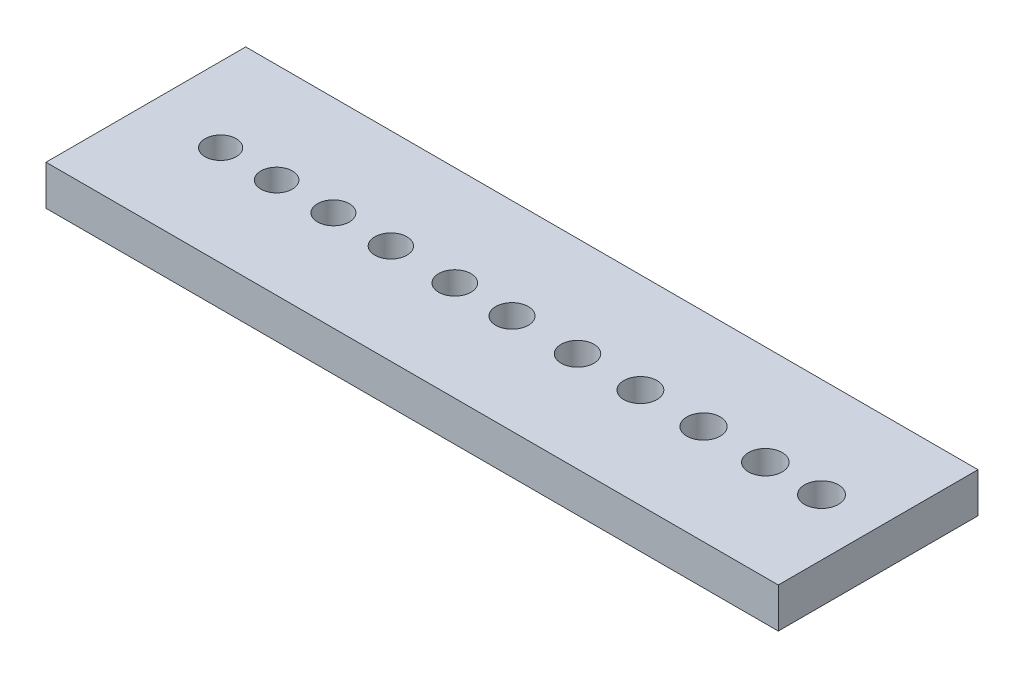
from build123d import *

# Parameters (mm, degrees)
CROQUIS1_W              = 55
CROQUIS1_H              = 15
CROQUIS1_R              = 1.175
CROQUIS1_R_2            = 1.185
CROQUIS1_R_3            = 1.195
CROQUIS1_R_4            = 1.205
CROQUIS1_R_5            = 1.215
CROQUIS1_R_6            = 1.225
CROQUIS1_R_7            = 1.235
CROQUIS1_R_8            = 1.245
CROQUIS1_R_9            = 1.255
CROQUIS1_R_10           = 1.265
CROQUIS1_R_11           = 1.275
SALIENTE_EXTRUIR1_DEPTH = 3


with BuildPart() as part:
    # Croquis1 → Saliente-Extruir1 (new body)
    with BuildSketch(Plane(origin=(0, 0, 0), x_dir=(1, 0, 0), z_dir=(0, 1, 0))):
        Rectangle(CROQUIS1_W, CROQUIS1_H)
        with Locations(Location((-21.88537105, 0, 0), (0, 0, 270))):
            Circle(CROQUIS1_R, mode=Mode.SUBTRACT)
        with Locations(Location((-17.678607244, 0, 0), (0, 0, 270))):
            Circle(CROQUIS1_R_2, mode=Mode.SUBTRACT)
        with Locations(Location((-13.4135496, 0, 0), (0, 0, 270))):
            Circle(CROQUIS1_R_3, mode=Mode.SUBTRACT)
        with Locations(Location((-9.099468305, 0, 0), (0, 0, 270))):
            Circle(CROQUIS1_R_4, mode=Mode.SUBTRACT)
        with Locations(Location((-4.295150499, 0, 0), (0, 0, 270))):
            Circle(CROQUIS1_R_5, mode=Mode.SUBTRACT)
        with Locations(Location((0, 0, 0), (0, 0, 270))):
            Circle(CROQUIS1_R_6, mode=Mode.SUBTRACT)
        with Locations(Location((4.921295904, 0, 0), (0, 0, 270))):
            Circle(CROQUIS1_R_7, mode=Mode.SUBTRACT)
        with Locations(Location((9.643654095, 0, 0), (0, 0, 270))):
            Circle(CROQUIS1_R_8, mode=Mode.SUBTRACT)
        with Locations(Location((14.38652568, 0, 0), (0, 0, 270))):
            Circle(CROQUIS1_R_9, mode=Mode.SUBTRACT)
        with Locations(Location((19.028560127, 0, 0), (0, 0, 270))):
            Circle(CROQUIS1_R_10, mode=Mode.SUBTRACT)
        with Locations(Location((23.245310452, 0, 0), (0, 0, 270))):
            Circle(CROQUIS1_R_11, mode=Mode.SUBTRACT)
    extrude(amount=SALIENTE_EXTRUIR1_DEPTH)


solid = part.part
